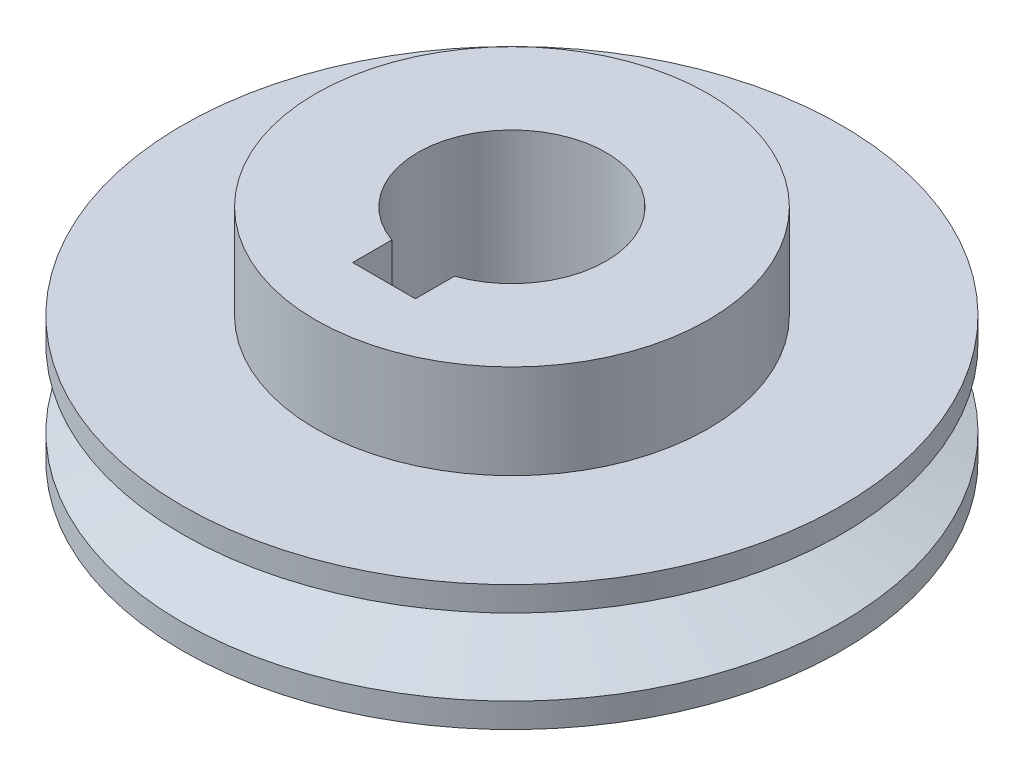
from build123d import *

# Parameters (mm, degrees)
CUT_EXTRUDE1_DEPTH      = 66.665820638
CUT_EXTRUDE1_DEPTH_BACK = 66.665820638
SKETCH2_W               = 8
SKETCH2_H               = 16.3


with BuildPart() as part:
    # Sketch1 → Revolve1 (revolve)
    with BuildSketch(Plane.XY, mode=Mode.PRIVATE) as revolve1_sk:
        Polygon((-12, 0), (-42, 0), (-42, 3.138538637), (-31, 6.501576133), (-31, 9.498423867), (-42, 12.861461363), (-42, 16), (-25, 16), (-25, 28), (-12, 28), align=None)
    revolve(revolve1_sk.sketch.rotate(Axis((0, 48.367469203, 0), (0, -1, 0)), 270), axis=Axis((0, 48.367469203, 0), (0, -1, 0)))

    # Sketch2 → Cut-Extrude1 (cut, two sides: drawn at the far end of the back side and taken through both)
    with BuildSketch(Plane(origin=(0, 0, 0), x_dir=(1, 0, 0), z_dir=(0, 1, 0)).offset(-CUT_EXTRUDE1_DEPTH_BACK)):
        with Locations((0, -8.15)):
            Rectangle(SKETCH2_W, SKETCH2_H)
    extrude(amount=CUT_EXTRUDE1_DEPTH + CUT_EXTRUDE1_DEPTH_BACK, mode=Mode.SUBTRACT)


solid = part.part
